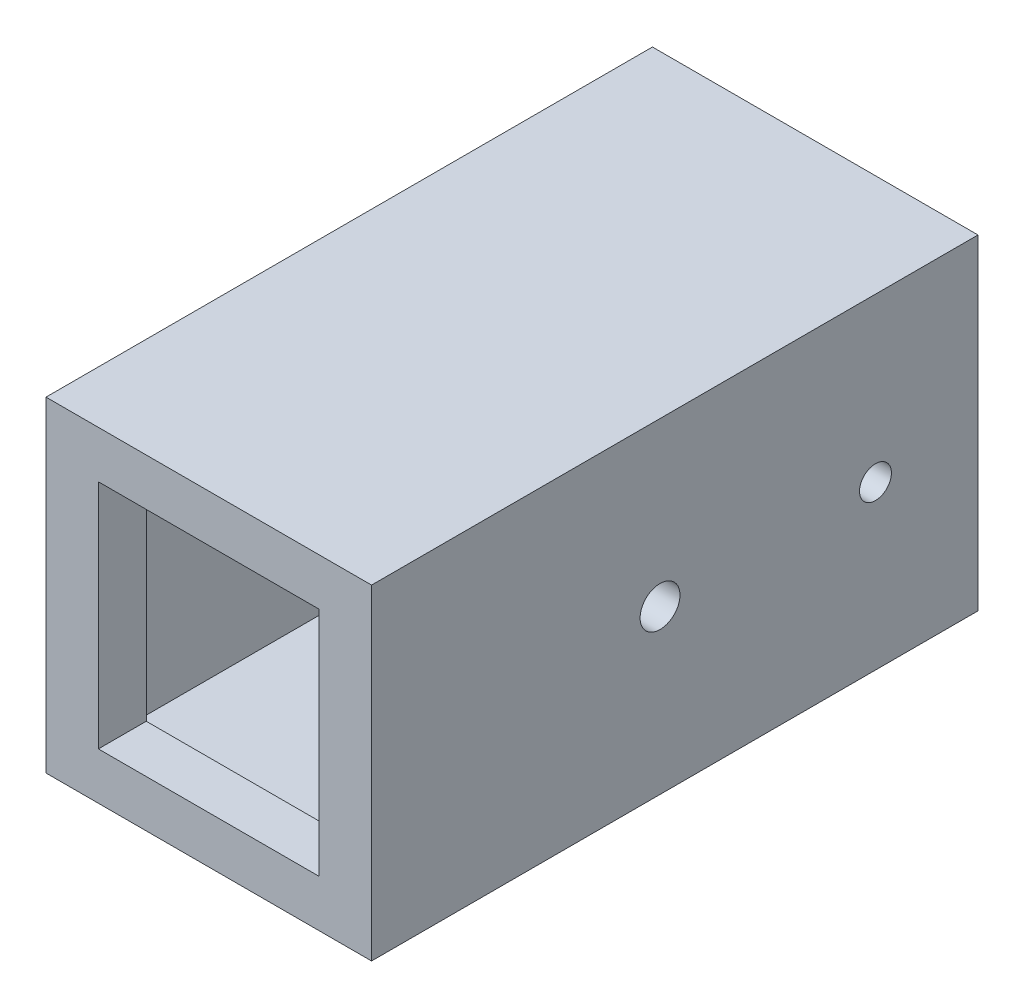
from build123d import *

# Parameters (mm, degrees)
SKETCH1_W           = 20.4
SKETCH1_H           = 20.4
SKETCH1_W_2         = 16.4
SKETCH1_H_2         = 16.4
BOSS_EXTRUDE1_DEPTH = 35
SKETCH2_W           = 20.4
SKETCH2_H           = 20.4
SKETCH2_W_2         = 13.834702386
SKETCH2_H_2         = 14.497254018
BOSS_EXTRUDE2_DEPTH = 3
SKETCH3_R           = 1.25
SKETCH3_R_2         = 1
CUT_EXTRUDE1_DEPTH  = 42.775590959
FILLET1_R           = 1


with BuildPart() as part:
    # Sketch1 → Boss-Extrude1 (new body)
    with BuildSketch(Plane.XY):
        Rectangle(SKETCH1_W, SKETCH1_H)
        Rectangle(SKETCH1_W_2, SKETCH1_H_2, mode=Mode.SUBTRACT)
    extrude(amount=-BOSS_EXTRUDE1_DEPTH)

    # Sketch2 → Boss-Extrude2 (add)
    with BuildSketch(Plane.XY):
        Rectangle(SKETCH2_W, SKETCH2_H)
        Rectangle(SKETCH2_W_2, SKETCH2_H_2, mode=Mode.SUBTRACT)
    extrude(amount=BOSS_EXTRUDE2_DEPTH)

    # Sketch3 → Cut-Extrude1 (cut, through all)
    with BuildSketch(Plane(origin=(10.2, 0, 0), x_dir=(0, 0, -1), z_dir=(1, 0, 0))):
        with Locations((15.075758147, 0)):
            Circle(SKETCH3_R)
        with Locations((28.575758147, 0)):
            Circle(SKETCH3_R_2)
    extrude(amount=-CUT_EXTRUDE1_DEPTH, mode=Mode.SUBTRACT)

    # Fillet1
    fillet1_edges = [part.edges().sort_by_distance(p)[0] for p in [
        (-8.2, 0, -35),
        (0, -8.2, -35),
        (8.2, 0, -35),
        (0, 8.2, -35),
    ]]
    fillet(fillet1_edges, radius=FILLET1_R)


solid = part.part
